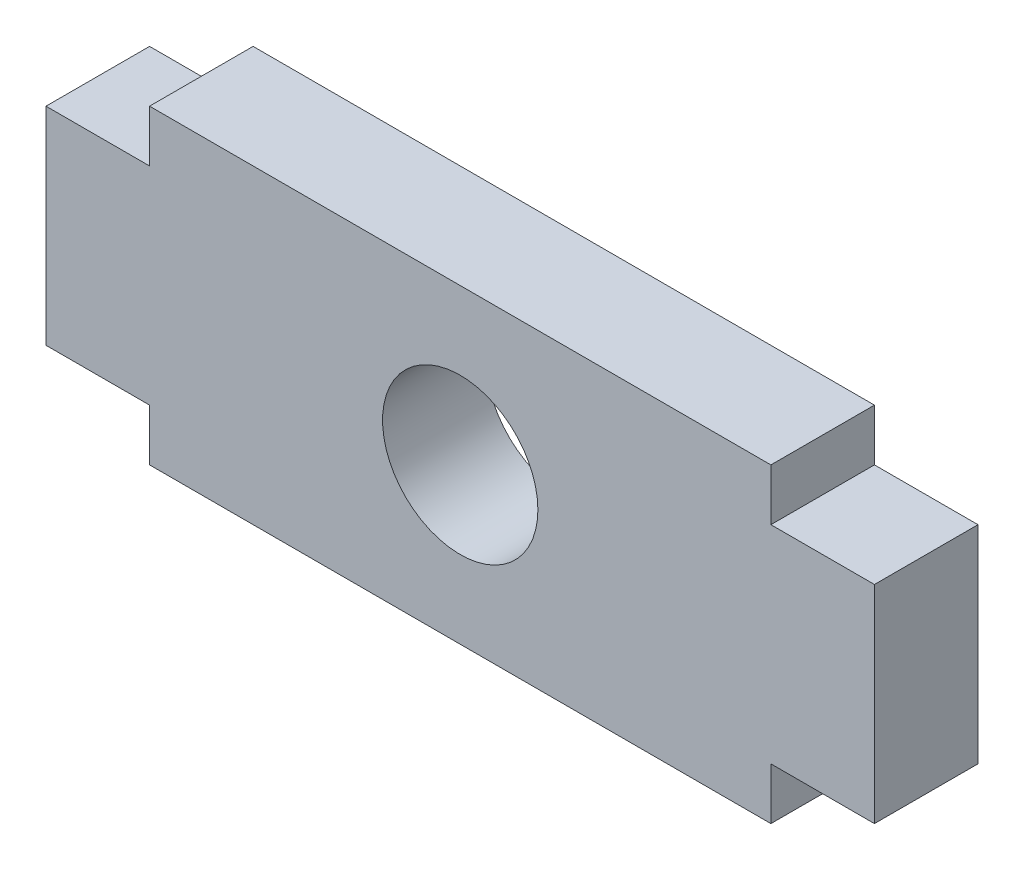
from build123d import *

# Parameters (mm, degrees)
SKETCH1_W           = 3.175
SKETCH1_H           = 6.35
SKETCH1_W_2         = 19.05
SKETCH1_H_2         = 9.525
SKETCH1_R           = 2.38125
BOSS_EXTRUDE1_DEPTH = 3.175


with BuildPart() as part:
    # Sketch1 → Boss-Extrude1 (new body)
    # profile 1 of 3: a face of its own
    with BuildSketch(Plane.XY):
        with Locations((-11.1125, 0)):
            Rectangle(SKETCH1_W, SKETCH1_H)
    # profile 2 of 3: a face of its own
    with BuildSketch(Plane.XY):
        Rectangle(SKETCH1_W_2, SKETCH1_H_2)
        Circle(SKETCH1_R, mode=Mode.SUBTRACT)
    # profile 3 of 3: a face of its own
    with BuildSketch(Plane.XY):
        with Locations((11.1125, 0)):
            Rectangle(SKETCH1_W, SKETCH1_H)
    extrude(amount=BOSS_EXTRUDE1_DEPTH)


solid = part.part
